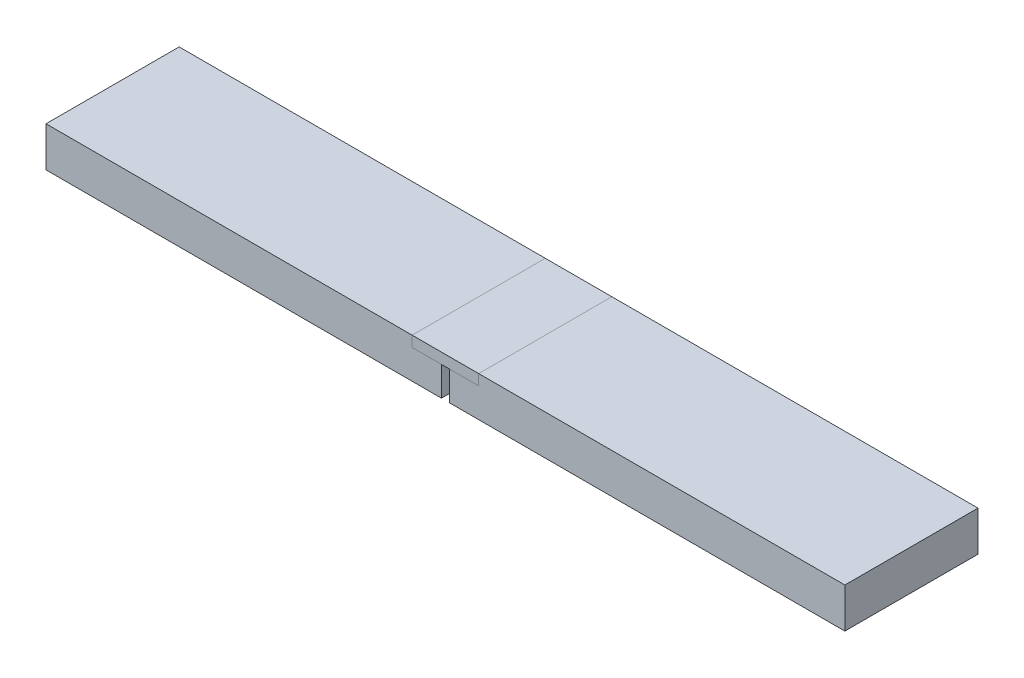
from build123d import *

# Parameters (mm, degrees)
SKETCH1_W           = 60
SKETCH1_H           = 10
BOSS_EXTRUDE1_DEPTH = 3
SKETCH3_W           = 0.6
SKETCH3_H           = 10
CUT_EXTRUDE1_DEPTH  = 2.2
SKETCH4_W           = 5
SKETCH4_H           = 10
CUT_EXTRUDE2_DEPTH  = 0.8
SKETCH5_W           = 5
SKETCH5_H           = 10
BOSS_EXTRUDE2_DEPTH = 0.8


with BuildPart() as part:
    # Sketch1 → Boss-Extrude1 (new body)
    with BuildSketch(Plane(origin=(0, 0, 0), x_dir=(1, 0, 0), z_dir=(0, 1, 0))):
        with Locations((8.695652174, -3.217391304)):
            Rectangle(SKETCH1_W, SKETCH1_H)
    extrude(amount=BOSS_EXTRUDE1_DEPTH)

    # Sketch3 → Cut-Extrude1 (cut)
    with BuildSketch(Plane.XZ):
        with Locations((8.695652174, 3.217391304)):
            Rectangle(SKETCH3_W, SKETCH3_H)
    extrude(amount=-CUT_EXTRUDE1_DEPTH, mode=Mode.SUBTRACT)

    # Sketch4 → Cut-Extrude2 (cut)
    with BuildSketch(Plane(origin=(0, 3, 0), x_dir=(1, 0, 0), z_dir=(0, 1, 0))):
        with Locations((8.695652174, -3.217391304)):
            Rectangle(SKETCH4_W, SKETCH4_H)
    extrude(amount=-CUT_EXTRUDE2_DEPTH, mode=Mode.SUBTRACT)


with BuildPart() as cut_extrude2_piece_1:
    # of the separate pieces the step leaves, piece 1, a body of its own (cut_extrude2_pieces)
    add(part.part.solids().sort_by_distance((-21.304347826, 0, 8.217391304))[0])


with BuildPart() as cut_extrude2_piece_2:
    # of the separate pieces the step leaves, piece 2, a body of its own (cut_extrude2_pieces)
    add(part.part.solids().sort_by_distance((8.995652174, 0, 8.217391304))[0])


with BuildPart() as body_3:
    # Sketch5 → Boss-Extrude2 (new body)
    with BuildSketch(Plane(origin=(0, 2.2, 0), x_dir=(1, 0, 0), z_dir=(0, 1, 0))):
        with Locations((8.695652174, -3.217391304)):
            Rectangle(SKETCH5_W, SKETCH5_H)
    extrude(amount=BOSS_EXTRUDE2_DEPTH)


solid = Compound([cut_extrude2_piece_1.part, cut_extrude2_piece_2.part, body_3.part])
